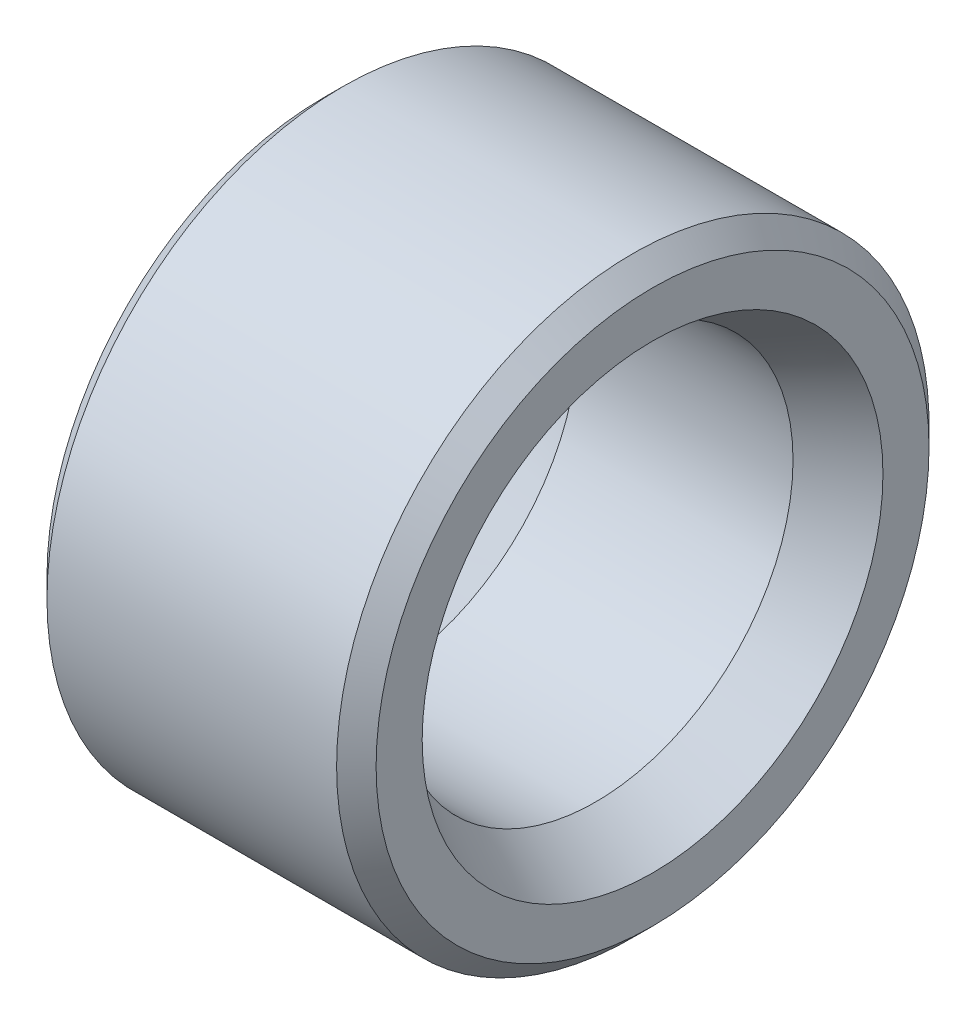
from build123d import *

# Parameters (mm, degrees)
SKETCH1_W     = 5
SKETCH1_H     = 1.5
CHAMFER1_SIZE = 0.3


with BuildPart() as part:
    # Sketch1 → Revolve1 (revolve)
    with BuildSketch(Plane.XY, mode=Mode.PRIVATE) as revolve1_sk:
        with Locations((2.5, 3.75)):
            Rectangle(SKETCH1_W, SKETCH1_H)
    revolve(revolve1_sk.sketch.rotate(Axis((0, 0, 0), (1, 0, 0)), 90), axis=Axis((0, 0, 0), (1, 0, 0)))

    # Chamfer1
    chamfer1_edges = [part.edges().sort_by_distance(p)[0] for p in [
        (5, 0, -4.5),
        (0, 0, -4.5),
    ]]
    chamfer(chamfer1_edges, length=CHAMFER1_SIZE)

    # Sketch2 → Cut-Revolve1 (revolve, cut)
    with BuildSketch(Plane.XY, mode=Mode.PRIVATE) as cut_revolve1_sk:
        Polygon((0, 3.5), (0, 3), (0.866025404, 3), align=None)
        Polygon((4.133974596, 3), (5, 3.5), (5, 3), align=None)
    revolve(cut_revolve1_sk.sketch.rotate(Axis((0, 0, 0), (1, 0, 0)), 90), axis=Axis((0, 0, 0), (1, 0, 0)), mode=Mode.SUBTRACT)


solid = part.part
